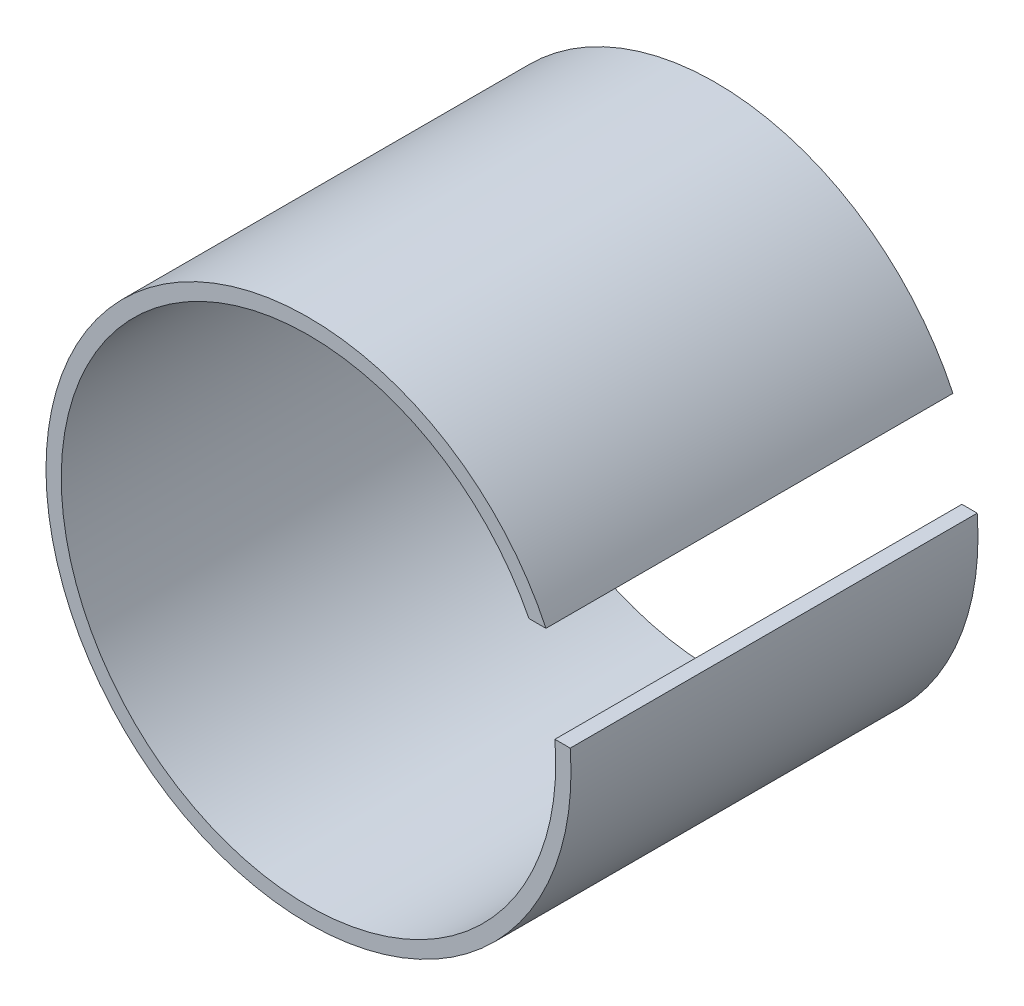
from build123d import *

# Parameters (mm, degrees)
EXTRUDE_1_DEPTH = 40


with BuildPart() as part:
    # Эскиз1 → Бобышка-Вытянуть1 (new body)
    with BuildSketch(Plane.XY):
        with BuildLine():
            Line((0, 25.8), (0, 24.3))
            ThreePointArc((0, 24.3), (12.712002203, 20.709780298), (21.667717923, 11))
            Line((21.667717923, 11), (23.337523433, 11))
            ThreePointArc((23.337523433, 11), (13.81738036, 21.78807013), (0, 25.8))
        make_face()
        with BuildLine():
            ThreePointArc((24.217555616, 2), (-16.460407042, -17.875821659), (0, 24.3))
            Line((0, 24.3), (0, 25.8))
            ThreePointArc((0, 25.8), (-17.521986189, -18.93726485), (25.722363811, 2))
            Line((25.722363811, 2), (24.217555616, 2))
        make_face()
    extrude(amount=EXTRUDE_1_DEPTH)


solid = part.part
